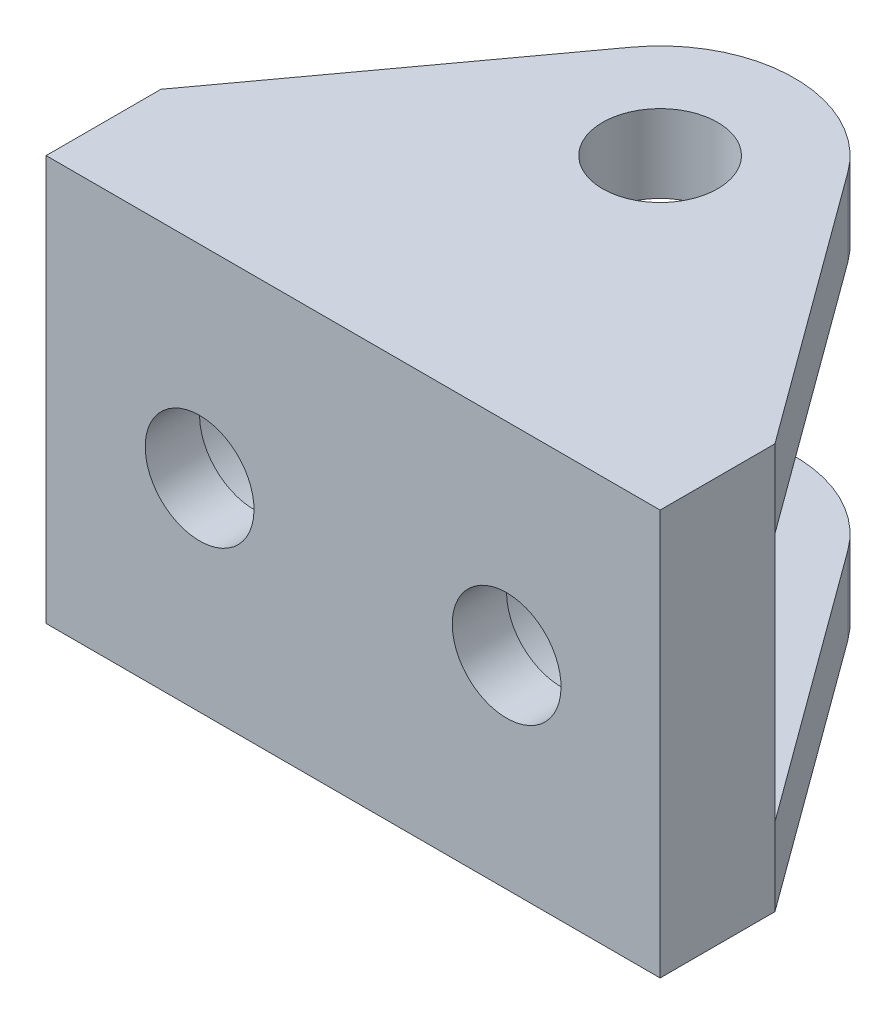
from build123d import *

# Parameters (mm, degrees)
SKETCH1_R                               = 4.7625
BOSS_EXTRUDE1_DEPTH                     = 33.528
CUT_EXTRUDE1_DEPTH                      = 71.978373046
CBORE_FOR_M8_HEX_HEAD_BOLT1_D           = 9
CBORE_FOR_M8_HEX_HEAD_BOLT1_CBORE_D     = 16
CBORE_FOR_M8_HEX_HEAD_BOLT1_CBORE_DEPTH = 5


with BuildPart() as part:
    # Sketch1 → Boss-Extrude1 (new body)
    with BuildSketch(Plane(origin=(0, 0, 0), x_dir=(1, 0, 0), z_dir=(0, 1, 0))):
        with BuildLine():
            Line((0, 0), (50.8, 0))
            Line((50.8, 0), (50.8, 9.4996))
            Line((50.8, 9.4996), (34.368896597, 31.960986975))
            ThreePointArc((34.368896597, 31.960986975), (25.4, 36.5125), (16.431103403, 31.960986975))
            Line((16.431103403, 31.960986975), (0, 9.4996))
            Line((0, 9.4996), (0, 0))
        make_face()
        with Locations(Location((25.4, 25.4, 0), (0, 0, 270))):
            Circle(SKETCH1_R, mode=Mode.SUBTRACT)
    extrude(amount=BOSS_EXTRUDE1_DEPTH)

    # Sketch2 → Cut-Extrude1 (cut, through all)
    with BuildSketch(Plane(origin=(50.8, 0, 0), x_dir=(0, 0, -1), z_dir=(1, 0, 0))):
        Polygon((9.4996, 16.764), (9.4996, 27.0891), (41.2496, 27.0891), (41.2496, 6.4389), (9.4996, 6.4389), align=None)
    extrude(amount=-CUT_EXTRUDE1_DEPTH, mode=Mode.SUBTRACT)

    # CBORE for M8 Hex Head Bolt1 (through all)
    with Locations(Plane(origin=(0, 0, -9.4996), x_dir=(-1, 0, 0), z_dir=(0, 0, -1))):
        with Locations((-12.7, 16.764), (-38.1, 16.764)):
            CounterBoreHole(CBORE_FOR_M8_HEX_HEAD_BOLT1_D / 2, CBORE_FOR_M8_HEX_HEAD_BOLT1_CBORE_D / 2, CBORE_FOR_M8_HEX_HEAD_BOLT1_CBORE_DEPTH)


solid = part.part
